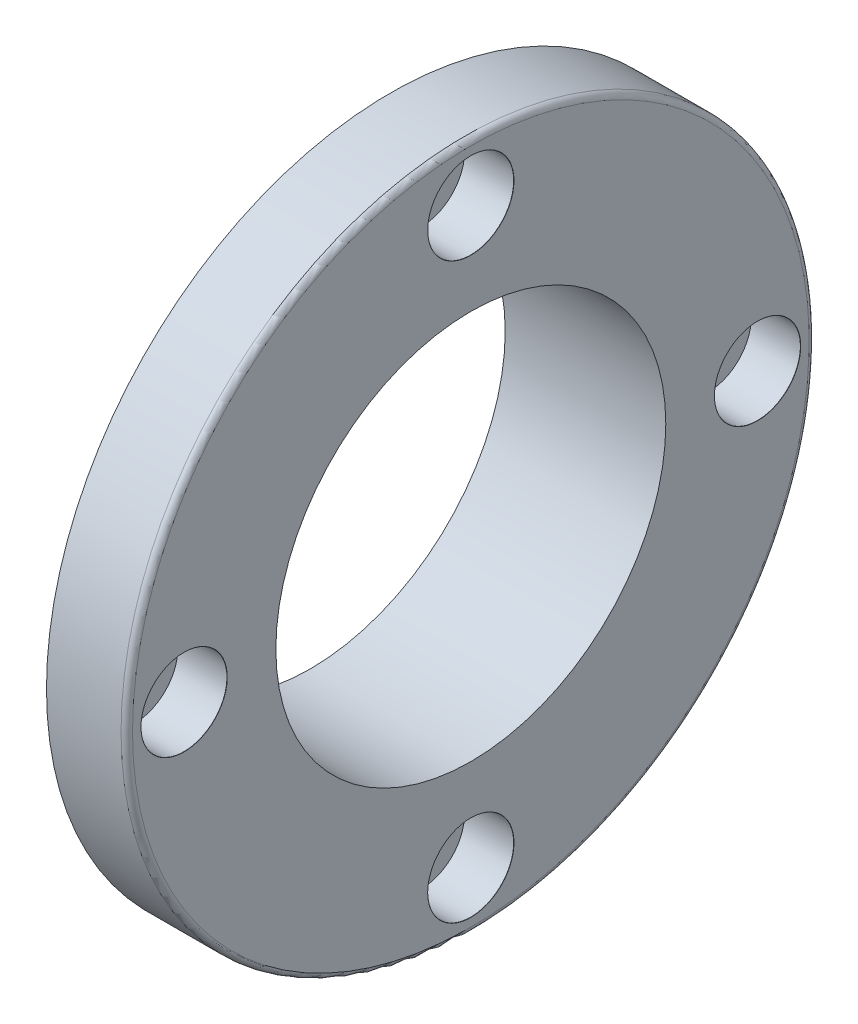
from build123d import *

# Parameters (mm, degrees)
CONG_1_R                     = 1
CHANFREIN1_SIZE              = 0.5
R_P_TITION_CIRCULAIRE1_COUNT = 4


with BuildPart() as part:
    # Esquisse1 → Révolution1 (revolve)
    with BuildSketch(Plane.XY, mode=Mode.PRIVATE) as r_volution1_sk:
        Polygon((81.575845111, 40), (95.575845111, 40), (95.575845111, 60), (109.575845111, 60), (109.575845111, 34), (81.575845111, 34), align=None)
    revolve(r_volution1_sk.sketch.rotate(Axis((0, 0, 0), (1, 0, 0)), 90), axis=Axis((0, 0, 0), (1, 0, 0)))

    # Congé1
    cong_1_edges = [part.edges().sort_by_distance(p)[0] for p in [
        (109.575845111, 0, -60),
    ]]
    fillet(cong_1_edges, radius=CONG_1_R)

    # Chanfrein1
    chanfrein1_edges = [part.edges().sort_by_distance(p)[0] for p in [
        (81.575845111, 0, -40),
    ]]
    chamfer(chanfrein1_edges, length=CHANFREIN1_SIZE)

    # Esquisse6 → Chambrage pour vis à six pans creux M81 (revolve, cut)
    with BuildSketch(Plane(origin=(109.575845111, 50, 0), x_dir=(0, 0, -1), z_dir=(0, 1, 0))):
        Polygon((0, 0), (0, 28), (4.5, 28), (4.5, 8.6), (7.5, 8.6), (7.5, 0.025), (7.525, 0), align=None)
    chambrage_pour_vis_six_pans_creux_m81 = revolve(axis=Axis((115.925845111, 50, 0), (-1, 0, 0)), mode=Mode.SUBTRACT)

    # Répétition circulaire1: Chambrage pour vis à six pans creux M81 ×4 about axis
    r_p_tition_circulaire1_axis = Axis((0, 0, 0), (1, 0, 0))
    for i in range(1, R_P_TITION_CIRCULAIRE1_COUNT):
        add(chambrage_pour_vis_six_pans_creux_m81.rotate(r_p_tition_circulaire1_axis, i * 360 / R_P_TITION_CIRCULAIRE1_COUNT), mode=Mode.SUBTRACT)


solid = part.part
